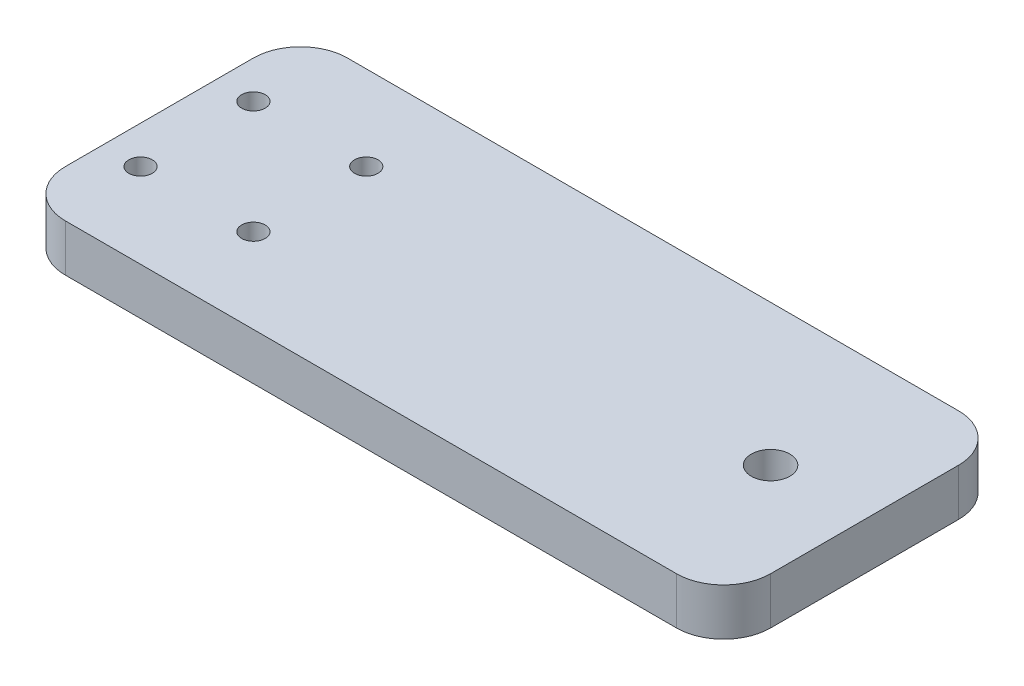
from build123d import *

# Parameters (mm, degrees)
SKETCH_1_W          = 150
SKETCH_1_H          = 60
EXTRUDE_1_DEPTH     = 10
FILLET_1_R          = 10
SKETCH_2_R          = 2.5
SKETCH_2_R_2        = 4.1
CUT_EXTRUDE_1_DEPTH = 82.39410298


with BuildPart() as part:
    # ｽｹｯﾁ1 → ﾎﾞｽ - 押し出し1 (new body)
    with BuildSketch(Plane(origin=(0, 0, 0), x_dir=(1, 0, 0), z_dir=(0, 1, 0))):
        Rectangle(SKETCH_1_W, SKETCH_1_H)
    extrude(amount=EXTRUDE_1_DEPTH)

    # ﾌｨﾚｯﾄ1
    fillet_1_edges = [part.edges().sort_by_distance(p)[0] for p in [
        (75, 5, 30),
        (-75, 5, 30),
        (-75, 5, -30),
        (75, 5, -30),
    ]]
    fillet(fillet_1_edges, radius=FILLET_1_R)

    # ｽｹｯﾁ2 → ｶｯﾄ - 押し出し1 (cut, through all)
    with BuildSketch(Plane(origin=(0, 10, 0), x_dir=(1, 0, 0), z_dir=(0, 1, 0))):
        with Locations(Location((-67, 12, 0), (0, 0, 270))):
            Circle(SKETCH_2_R)
        with Locations(Location((-43, 12, 0), (0, 0, 270))):
            Circle(SKETCH_2_R)
        with Locations(Location((-67, -12, 0), (0, 0, 270))):
            Circle(SKETCH_2_R)
        with Locations(Location((-43, -12, 0), (0, 0, 270))):
            Circle(SKETCH_2_R)
        with Locations(Location((55, 0, 0), (0, 0, 270))):
            Circle(SKETCH_2_R_2)
    extrude(amount=-CUT_EXTRUDE_1_DEPTH, mode=Mode.SUBTRACT)


solid = part.part
